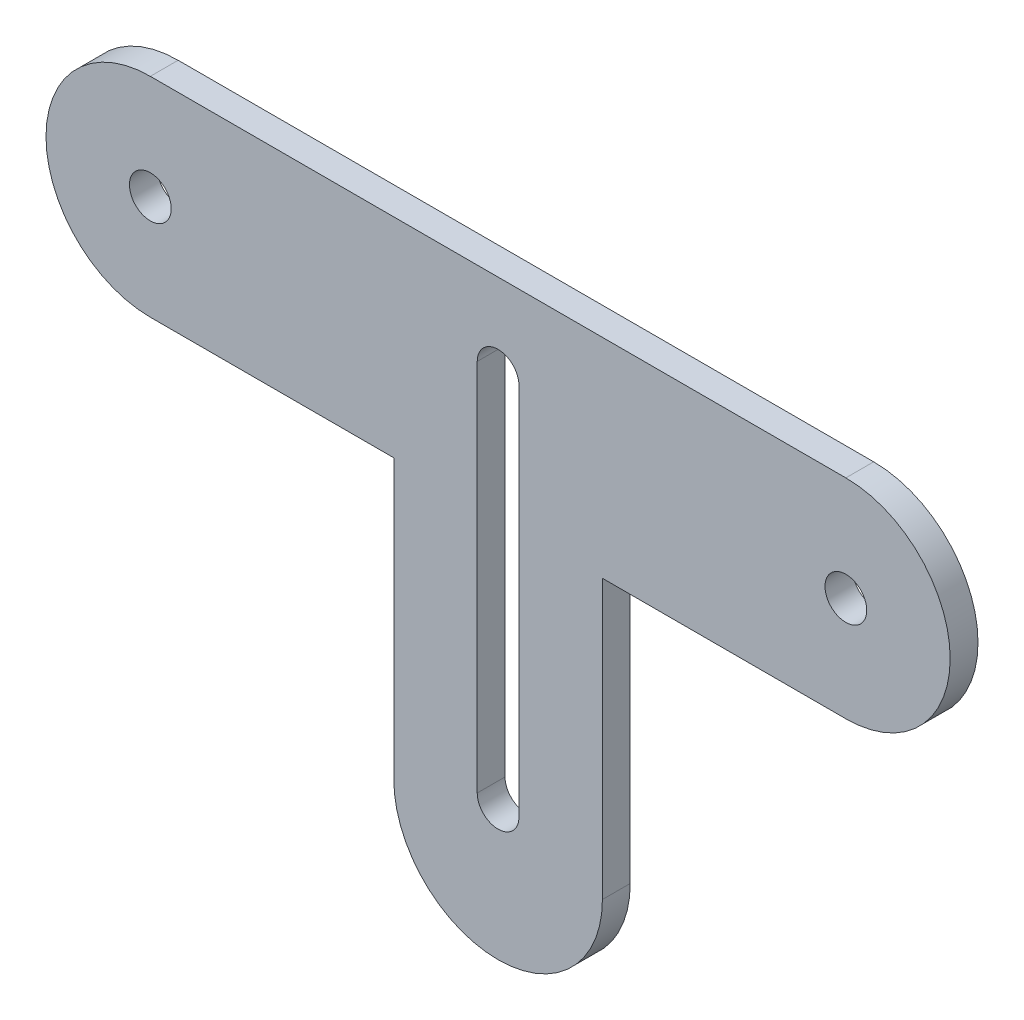
from build123d import *

# Parameters (mm, degrees)
EXTRUDE_1_DEPTH     = 2
CUT_EXTRUDE_2_DEPTH = 59.758033272
SKETCH_3_R          = 1.5
CUT_EXTRUDE_1_DEPTH = 59.758033272


with BuildPart() as part:
    # 草图1 → 凸台-拉伸1 (new body)
    with BuildSketch(Plane.XY):
        with BuildLine():
            Line((-35.244286067, 2.232984072), (14.755713933, 2.232984072))
            ThreePointArc((14.755713933, 2.232984072), (22.255713134, -5.267016727), (14.755712334, -12.767015928))
            Line((14.755712334, -12.767015928), (-2.744287666, -12.767015928))
            Line((-2.744287666, -12.767015928), (-2.744287666, -32.767015928))
            ThreePointArc((-2.744287666, -32.767015928), (-10.244286561, -40.267014822), (-17.744285455, -32.767015928))
            Line((-17.744285455, -32.767015928), (-17.744285455, -12.767015928))
            Line((-17.744285455, -12.767015928), (-35.244285455, -12.767015928))
            ThreePointArc((-35.244285455, -12.767015928), (-42.744286067, -5.267016233), (-35.244286067, 2.232984072))
        make_face()
    extrude(amount=EXTRUDE_1_DEPTH)

    # 草图2 → 切除-拉伸2 (cut, through all)
    with BuildSketch(Plane.XY.offset(2)):
        with BuildLine():
            Line((-11.744285455, -3.767015928), (-11.744285455, -30.635435278))
            ThreePointArc((-11.744285455, -30.635435278), (-10.244286561, -32.135434173), (-8.744287666, -30.635435278))
            Line((-8.744287666, -30.635435278), (-8.744287666, -3.767015928))
            ThreePointArc((-8.744287666, -3.767015928), (-10.244286561, -2.267017033), (-11.744285455, -3.767015928))
        make_face()
    extrude(amount=-CUT_EXTRUDE_2_DEPTH, mode=Mode.SUBTRACT)

    # 草图3 → 切除-拉伸1 (cut, through all)
    with BuildSketch(Plane(origin=(0, 0, 0), x_dir=(-1, 0, 0), z_dir=(0, 0, -1))):
        with Locations((-14.755712334, -5.267015928)):
            Circle(SKETCH_3_R)
        with Locations((35.244285455, -5.267015928)):
            Circle(SKETCH_3_R)
    extrude(amount=-CUT_EXTRUDE_1_DEPTH, mode=Mode.SUBTRACT)


solid = part.part
